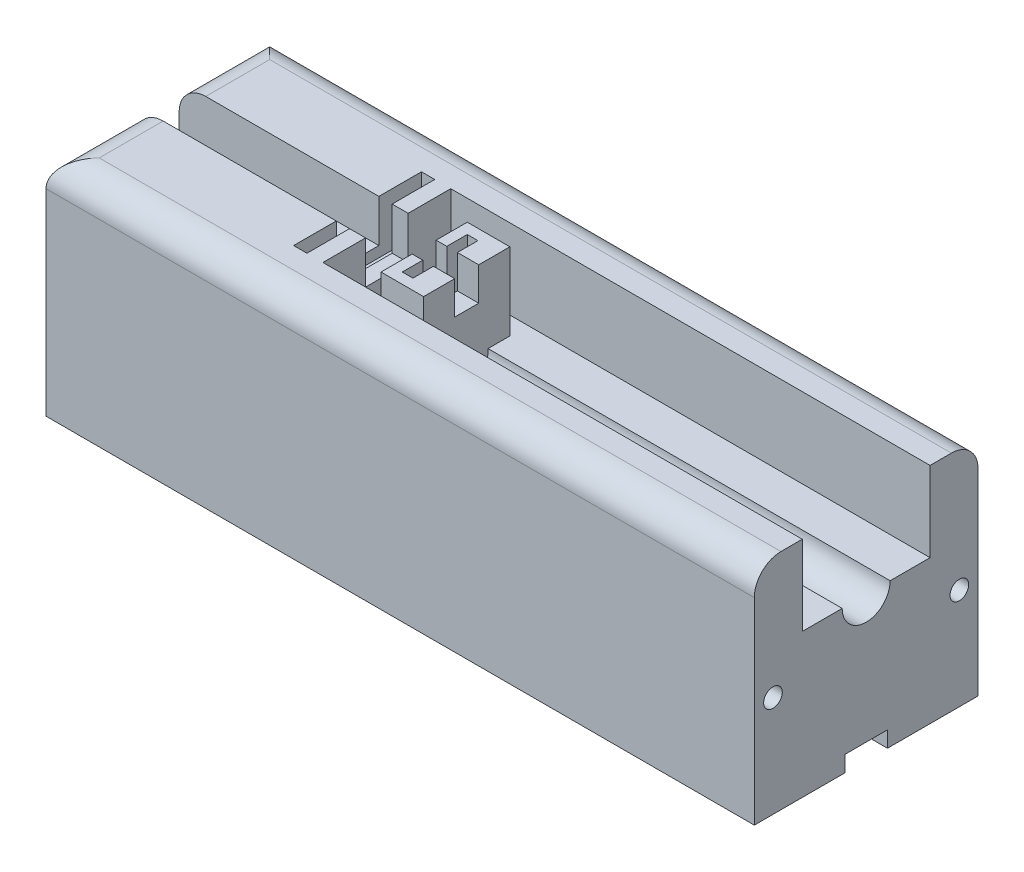
from build123d import *

# Parameters (mm, degrees)
BOSS_EXTRUDE1_DEPTH      = 8
BOSS_EXTRUDE1_DEPTH_BACK = 75
SKETCH3_W                = 2.5
SKETCH3_H                = 24
CUT_EXTRUDE1_DEPTH       = 10
BOSS_EXTRUDE6_DEPTH      = 90
BOSS_EXTRUDE6_DEPTH_BACK = 83
BOSS_EXTRUDE7_DEPTH      = 90
SKETCH8_W                = 7
SKETCH8_H                = 16.2
CUT_EXTRUDE2_DEPTH       = 15
SKETCH9_W                = 2
SKETCH9_H                = 12.2
CUT_EXTRUDE3_DEPTH       = 10
CUT_EXTRUDE4_DEPTH       = 90
CUT_EXTRUDE5_DEPTH       = 75
CUT_EXTRUDE6_DEPTH       = 90
CUT_EXTRUDE6_DEPTH_BACK  = 83
SKETCH13_R               = 1.75
SKETCH14_R               = 2
CUT_EXTRUDE7_DEPTH       = 83
SKETCH16_R               = 1.75
CUT_EXTRUDE8_DEPTH       = 3
CUT_EXTRUDE9_DEPTH       = 170
SKETCH18_R               = 2
CUT_EXTRUDE10_DEPTH      = 15
SKETCH19_W               = 8
SKETCH19_H               = 3
CUT_EXTRUDE11_DEPTH      = 3
CUT_EXTRUDE12_DEPTH      = 7
SKETCH21_W               = 7
SKETCH21_H               = 4.5
CUT_EXTRUDE13_DEPTH      = 17
SKETCH22_W               = 40
SKETCH22_H               = 42
CUT_EXTRUDE14_DEPTH      = 42
FILLET1_R                = 5


with BuildPart() as part:
    # Sketch2 → Boss-Extrude1 (new, two sides: drawn at the far end of the back side and taken through both)
    with BuildSketch(Plane(origin=(0, 0, 0), x_dir=(0, 0, -1), z_dir=(1, 0, 0)).offset(-BOSS_EXTRUDE1_DEPTH_BACK)):
        Polygon((-21, 0), (-21, 15), (-4, 15), (-4, 7), (0, 7), (4, 7), (4, 15), (21, 15), (21, 0), (0, 0), align=None)
    extrude(amount=BOSS_EXTRUDE1_DEPTH + BOSS_EXTRUDE1_DEPTH_BACK)

    # Sketch3 → Cut-Extrude1 (cut)
    with BuildSketch(Plane(origin=(0, 15, 0), x_dir=(-1, 0, 0), z_dir=(0, 1, 0))):
        with Locations((-3.75, 0)):
            Rectangle(SKETCH3_W, SKETCH3_H)
    extrude(amount=-CUT_EXTRUDE1_DEPTH, mode=Mode.SUBTRACT)

    # Sketch6 → Boss-Extrude6 (add, two sides: drawn at the far end of the back side and taken through both)
    with BuildSketch(Plane(origin=(8, 0, 0), x_dir=(0, 0, -1), z_dir=(1, 0, 0)).offset(-BOSS_EXTRUDE6_DEPTH_BACK)):
        Polygon((-12, 15), (-12, 0), (12, 0), (12, 15), (21, 15), (21, -27), (-21, -27), (-21, 15), align=None)
    extrude(amount=BOSS_EXTRUDE6_DEPTH + BOSS_EXTRUDE6_DEPTH_BACK)

    # Sketch7 → Boss-Extrude7 (add)
    with BuildSketch(Plane(origin=(8, 0, 0), x_dir=(0, 0, -1), z_dir=(1, 0, 0))):
        Polygon((2.25, 15), (2.25, 8.75), (-2.25, 8.75), (-2.25, 15), (-8.1, 15), (-8.1, 11), (-8.1, 0), (8.1, 0), (8.1, 11), (8.1, 15), align=None)
    extrude(amount=BOSS_EXTRUDE7_DEPTH)

    # Sketch8 → Cut-Extrude2 (cut)
    with BuildSketch(Plane(origin=(0, 15, 0), x_dir=(-1, 0, 0), z_dir=(0, 1, 0))):
        with Locations((-11.5, 0)):
            Rectangle(SKETCH8_W, SKETCH8_H)
    extrude(amount=-CUT_EXTRUDE2_DEPTH, mode=Mode.SUBTRACT)

    # Sketch9 → Cut-Extrude3 (cut)
    with BuildSketch(Plane(origin=(0, 15, 0), x_dir=(-1, 0, 0), z_dir=(0, 1, 0))):
        with Locations((-18, 0)):
            Rectangle(SKETCH9_W, SKETCH9_H)
    extrude(amount=-CUT_EXTRUDE3_DEPTH, mode=Mode.SUBTRACT)

    # Sketch11 → Cut-Extrude4 (cut)
    with BuildSketch(Plane(origin=(98, 0, 0), x_dir=(0, 0, -1), z_dir=(1, 0, 0))):
        with BuildLine():
            Line((4.5, 0), (8.1, 0))
            Line((8.1, 0), (8.1, 0.5))
            Line((8.1, 0.5), (4, 0.5))
            Line((4, 0.5), (4, 0))
            ThreePointArc((4, 0), (0, -4), (-4, 0))
            Line((-4, 0), (-4, 0.5))
            Line((-4, 0.5), (-8.1, 0.5))
            Line((-8.1, 0.5), (-8.1, 0))
            Line((-8.1, 0), (-4.5, 0))
            ThreePointArc((-4.5, 0), (0, -4.5), (4.5, 0))
        make_face()
    extrude(amount=-CUT_EXTRUDE4_DEPTH, mode=Mode.SUBTRACT)

    # Sketch12 → Cut-Extrude5 (cut)
    with BuildSketch(Plane(origin=(98, 0, 0), x_dir=(0, 0, -1), z_dir=(1, 0, 0))):
        with BuildLine():
            Line((-2.25, 15), (-8.1, 15))
            Line((-8.1, 15), (-8.1, 0.5))
            Line((-8.1, 0.5), (-4, 0.5))
            Line((-4, 0.5), (-4, 0))
            ThreePointArc((-4, 0), (0, -4), (4, 0))
            Line((4, 0), (4, 0.5))
            Line((4, 0.5), (8.1, 0.5))
            Line((8.1, 0.5), (8.1, 15))
            Line((8.1, 15), (2.25, 15))
            Line((2.25, 15), (2.25, 8.75))
            Line((2.25, 8.75), (-2.25, 8.75))
            Line((-2.25, 8.75), (-2.25, 15))
        make_face()
    extrude(amount=-CUT_EXTRUDE5_DEPTH, mode=Mode.SUBTRACT)

    # Sketch13 → Cut-Extrude6 (cut, two sides: drawn at the far end of the back side and taken through both)
    with BuildSketch(Plane(origin=(8, 0, 0), x_dir=(0, 0, -1), z_dir=(1, 0, 0)).offset(-CUT_EXTRUDE6_DEPTH_BACK)):
        Circle(SKETCH13_R)
    extrude(amount=CUT_EXTRUDE6_DEPTH + CUT_EXTRUDE6_DEPTH_BACK, mode=Mode.SUBTRACT)

    # Sketch14 → Cut-Extrude7 (cut)
    with BuildSketch(Plane(origin=(8, 0, 0), x_dir=(0, 0, -1), z_dir=(1, 0, 0))):
        Circle(SKETCH14_R)
    extrude(amount=-CUT_EXTRUDE7_DEPTH, mode=Mode.SUBTRACT)

    # Sketch16 → Cut-Extrude8 (cut)
    with BuildSketch(Plane(origin=(98, 0, 0), x_dir=(0, 0, -1), z_dir=(1, 0, 0))):
        with Locations((17.5, -8)):
            Circle(SKETCH16_R)
        with Locations((-17.5, -8)):
            Circle(SKETCH16_R)
    extrude(amount=-CUT_EXTRUDE8_DEPTH, mode=Mode.SUBTRACT)

    # Sketch17 → Cut-Extrude9 (cut)
    with BuildSketch(Plane(origin=(95, 0, 0), x_dir=(0, 0, -1), z_dir=(1, 0, 0))):
        Polygon((18, -6), (18, -27), (-18, -27), (-18, -6), (-4.5, -6), (-4.5, -9), (4.5, -9), (4.5, -6), align=None)
    extrude(amount=-CUT_EXTRUDE9_DEPTH, mode=Mode.SUBTRACT)

    # Sketch18 → Cut-Extrude10 (cut)
    with BuildSketch(Plane(origin=(95, 0, 0), x_dir=(0, 0, -1), z_dir=(1, 0, 0))):
        with Locations((-17.5, -8)):
            Circle(SKETCH18_R)
        with Locations((17.5, -8)):
            Circle(SKETCH18_R)
    extrude(amount=-CUT_EXTRUDE10_DEPTH, mode=Mode.SUBTRACT)

    # Sketch19 → Cut-Extrude11 (cut)
    with BuildSketch(Plane(origin=(95, 0, 0), x_dir=(0, 0, -1), z_dir=(1, 0, 0))):
        with Locations((0, -25.5)):
            Rectangle(SKETCH19_W, SKETCH19_H)
    extrude(amount=CUT_EXTRUDE11_DEPTH, mode=Mode.SUBTRACT)

    # Sketch20 → Cut-Extrude12 (cut)
    with BuildSketch(Plane(origin=(8, 0, 0), x_dir=(0, 0, -1), z_dir=(1, 0, 0))):
        with BuildLine():
            Line((-3.878333303, -1), (3.878323052, -1.000039756))
            ThreePointArc((3.878323052, -1.000039756), (-2.0528e-05, -4.005180297), (-3.878333303, -1))
        make_face()
    extrude(amount=CUT_EXTRUDE12_DEPTH, mode=Mode.SUBTRACT)

    # Sketch21 → Cut-Extrude13 (cut)
    with BuildSketch(Plane(origin=(0, 15, 0), x_dir=(-1, 0, 0), z_dir=(0, 1, 0))):
        with Locations((-11.5, 0)):
            Rectangle(SKETCH21_W, SKETCH21_H)
    extrude(amount=-CUT_EXTRUDE13_DEPTH, mode=Mode.SUBTRACT)

    # Sketch22 → Cut-Extrude14 (cut)
    with BuildSketch(Plane(origin=(0, 15, 0), x_dir=(-1, 0, 0), z_dir=(0, 1, 0))):
        with Locations((55, 0)):
            Rectangle(SKETCH22_W, SKETCH22_H)
    extrude(amount=-CUT_EXTRUDE14_DEPTH, mode=Mode.SUBTRACT)

    # Fillet1
    fillet1_edges = [part.edges().sort_by_distance(p)[0] for p in [
        (31.5, 15, -21),
        (31.5, 15, 21),
        (-35, 15, 12.5),
        (-35, 15, -12.5),
    ]]
    fillet(fillet1_edges, radius=FILLET1_R)


solid = part.part
